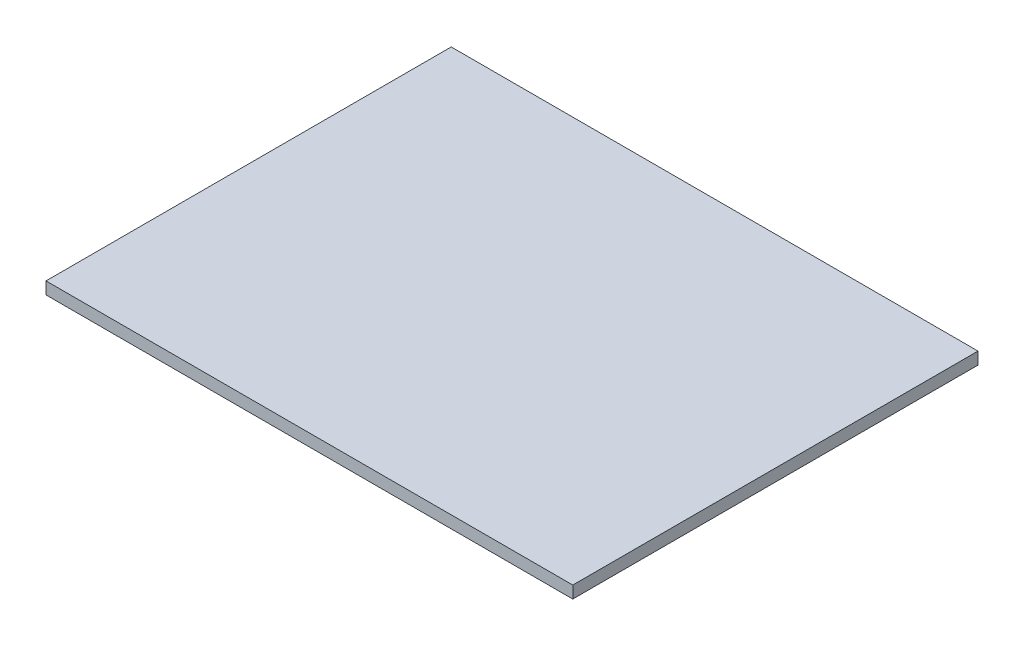
from build123d import *

# Parameters (mm, degrees)
SKETCH1_W           = 130
SKETCH1_H           = 100
BOSS_EXTRUDE1_DEPTH = 3


with BuildPart() as part:
    # Sketch1 → Boss-Extrude1 (new body)
    with BuildSketch(Plane(origin=(0, 0, 0), x_dir=(1, 0, 0), z_dir=(0, 1, 0))):
        Rectangle(SKETCH1_W, SKETCH1_H)
    extrude(amount=BOSS_EXTRUDE1_DEPTH)


solid = part.part
